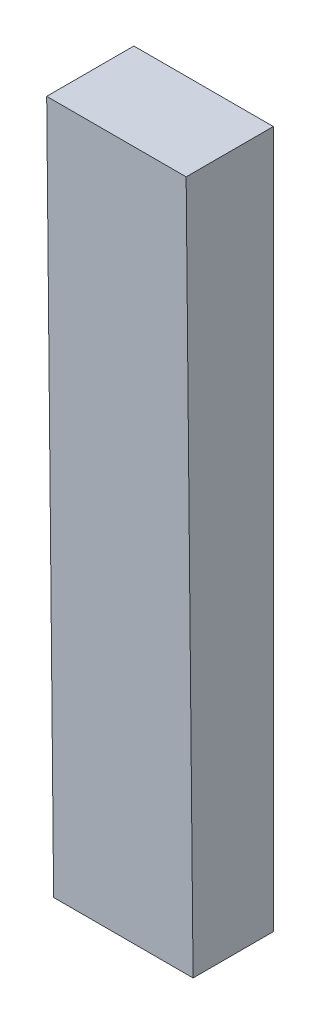
from build123d import *

# Parameters (mm, degrees)
BOSS_EXTRUDE1_DEPTH = 32


with BuildPart() as part:
    # Sketch1 → Boss-Extrude1 (new body)
    with BuildSketch(Plane.YZ):
        Polygon((0, 0), (-160, 0), (-160, 18.408207208), (0, 20), align=None)
    extrude(amount=BOSS_EXTRUDE1_DEPTH)


solid = part.part
